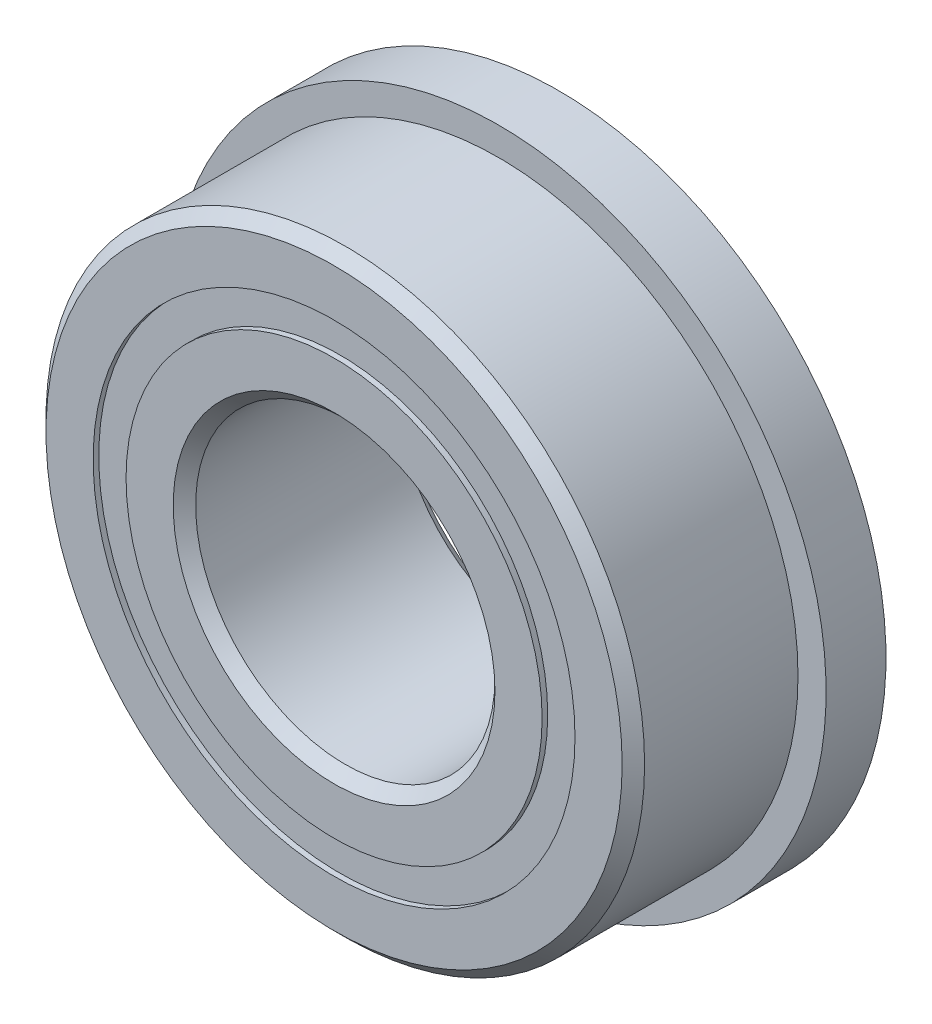
from build123d import *

# Parameters (mm, degrees)
CIRPATTERN1_COUNT = 12
SKETCH5_W         = 1.147826059
SKETCH5_H         = 0.697802198
SKETCH6_W         = 1.27
SKETCH6_H         = 1.835498901


with BuildPart() as part:
    # Sketch → Revolve1 (revolve)
    with BuildSketch(Plane(origin=(0, 0, 0), x_dir=(0, 0, -1), z_dir=(1, 0, 0)), mode=Mode.PRIVATE) as revolve1_sk:
        with BuildLine():
            Line((2.143125, 6.35), (-2.143125, 6.35))
            Line((-2.143125, 6.35), (-2.38125, 6.111875))
            Line((-2.38125, 6.111875), (-2.38125, 5.111401099))
            Line((-2.38125, 5.111401099), (-1.058333333, 5.111401099))
            ThreePointArc((-1.058333333, 5.111401099), (0, 5.876861441), (1.058333333, 5.111401099))
            Line((1.058333333, 5.111401099), (2.38125, 5.111401099))
            Line((2.38125, 5.111401099), (2.38125, 6.111875))
            Line((2.38125, 6.111875), (2.143125, 6.35))
        make_face()
    revolve(revolve1_sk.sketch.rotate(Axis((0, 0, 2.38125), (0, 0, -1)), 90), axis=Axis((0, 0, 2.38125), (0, 0, -1)))

    # Sketch6 → Revolve6 (revolve)
    with BuildSketch(Plane(origin=(0, 0, 0), x_dir=(0, 0, -1), z_dir=(1, 0, 0)), mode=Mode.PRIVATE) as revolve6_sk:
        with Locations((1.74625, 6.02915055)):
            Rectangle(SKETCH6_W, SKETCH6_H)
    revolve(revolve6_sk.sketch.rotate(Axis((0, 0, -2.38125), (0, 0, 1)), 270), axis=Axis((0, 0, -2.38125), (0, 0, 1)))


with BuildPart() as body_2:
    # Sketch3 → Revolve3 (revolve)
    with BuildSketch(Plane(origin=(0, 0, 0), x_dir=(0, 0, -1), z_dir=(1, 0, 0)), mode=Mode.PRIVATE) as revolve3_sk:
        with BuildLine():
            Line((-2.38125, 4.413598901), (-1.058333333, 4.413598901))
            ThreePointArc((-1.058333333, 4.413598901), (0, 3.648138559), (1.058333333, 4.413598901))
            Line((1.058333333, 4.413598901), (2.38125, 4.413598901))
            Line((2.38125, 4.413598901), (2.38125, 3.413125))
            Line((2.38125, 3.413125), (2.143125, 3.175))
            Line((2.143125, 3.175), (-2.143125, 3.175))
            Line((-2.143125, 3.175), (-2.38125, 3.413125))
            Line((-2.38125, 3.413125), (-2.38125, 4.413598901))
        make_face()
    revolve(revolve3_sk.sketch.rotate(Axis((0, 0, 2.38125), (0, 0, -1)), 90), axis=Axis((0, 0, 2.38125), (0, 0, -1)))


with BuildPart() as body_3:
    # Sketch4 → Revolve4 (revolve)
    with BuildSketch(Plane(origin=(0, 0, 0), x_dir=(0, 0, -1), z_dir=(1, 0, 0))):
        with BuildLine():
            Line((-1.114361441, 4.7625), (1.114361441, 4.7625))
            ThreePointArc((1.114361441, 4.7625), (0, 5.876861441), (-1.114361441, 4.7625))
        make_face()
    revolve(axis=Axis((0, 4.7625, 1.114361441), (0, 0, -1)))


with BuildPart() as cirpattern1_1:
    # CirPattern1: pattern copy
    add(body_3.part.rotate(Axis((0, 0, 0), (0, 0, 1)), 1 * 360 / CIRPATTERN1_COUNT))


with BuildPart() as cirpattern1_2:
    # CirPattern1: pattern copy
    add(body_3.part.rotate(Axis((0, 0, 0), (0, 0, 1)), 2 * 360 / CIRPATTERN1_COUNT))


with BuildPart() as cirpattern1_3:
    # CirPattern1: pattern copy
    add(body_3.part.rotate(Axis((0, 0, 0), (0, 0, 1)), 3 * 360 / CIRPATTERN1_COUNT))


with BuildPart() as cirpattern1_4:
    # CirPattern1: pattern copy
    add(body_3.part.rotate(Axis((0, 0, 0), (0, 0, 1)), 4 * 360 / CIRPATTERN1_COUNT))


with BuildPart() as cirpattern1_5:
    # CirPattern1: pattern copy
    add(body_3.part.rotate(Axis((0, 0, 0), (0, 0, 1)), 5 * 360 / CIRPATTERN1_COUNT))


with BuildPart() as cirpattern1_6:
    # CirPattern1: pattern copy
    add(body_3.part.rotate(Axis((0, 0, 0), (0, 0, 1)), 6 * 360 / CIRPATTERN1_COUNT))


with BuildPart() as cirpattern1_7:
    # CirPattern1: pattern copy
    add(body_3.part.rotate(Axis((0, 0, 0), (0, 0, 1)), 7 * 360 / CIRPATTERN1_COUNT))


with BuildPart() as cirpattern1_8:
    # CirPattern1: pattern copy
    add(body_3.part.rotate(Axis((0, 0, 0), (0, 0, 1)), 8 * 360 / CIRPATTERN1_COUNT))


with BuildPart() as cirpattern1_9:
    # CirPattern1: pattern copy
    add(body_3.part.rotate(Axis((0, 0, 0), (0, 0, 1)), 9 * 360 / CIRPATTERN1_COUNT))


with BuildPart() as cirpattern1_10:
    # CirPattern1: pattern copy
    add(body_3.part.rotate(Axis((0, 0, 0), (0, 0, 1)), 10 * 360 / CIRPATTERN1_COUNT))


with BuildPart() as cirpattern1_11:
    # CirPattern1: pattern copy
    add(body_3.part.rotate(Axis((0, 0, 0), (0, 0, 1)), 11 * 360 / CIRPATTERN1_COUNT))


with BuildPart() as body_15:
    # Sketch5 → Revolve5 (revolve)
    with BuildSketch(Plane(origin=(0, 0, 0), x_dir=(0, 0, -1), z_dir=(1, 0, 0)), mode=Mode.PRIVATE) as revolve5_sk:
        with Locations((-1.688274471, 4.7625)):
            Rectangle(SKETCH5_W, SKETCH5_H)
        with Locations((1.688274471, 4.7625)):
            Rectangle(SKETCH5_W, SKETCH5_H)
    revolve(revolve5_sk.sketch.rotate(Axis((0, 0, 2.38125), (0, 0, -1)), 90), axis=Axis((0, 0, 2.38125), (0, 0, -1)))


solid = Compound([part.part, body_2.part, body_3.part, cirpattern1_1.part, cirpattern1_2.part, cirpattern1_3.part, cirpattern1_4.part, cirpattern1_5.part, cirpattern1_6.part, cirpattern1_7.part, cirpattern1_8.part, cirpattern1_9.part, cirpattern1_10.part, cirpattern1_11.part, body_15.part])
